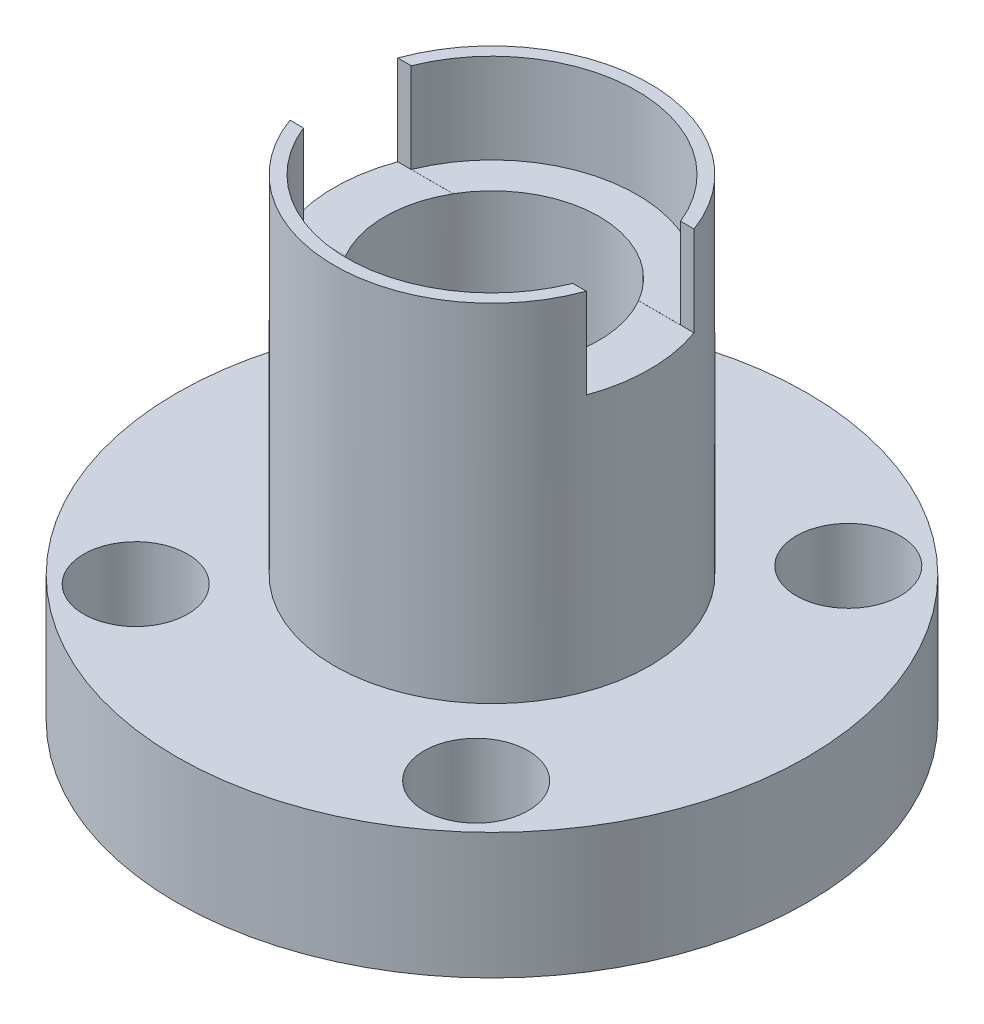
from build123d import *

# Parameters (mm, degrees)
SKETCH_1_R                   = 10
EXTRUDE_1_DEPTH              = 4
SKETCH_4_R                   = 1.65
CUT_EXTRUDE_1_DEPTH          = 4
SKETCH_5_R                   = 5
EXTRUDE_2_DEPTH              = 11
HOLE_WIZARD_M8_1_D           = 6.8
HOLE_WIZARD_M8_1_ON_FACE_2_D = 6.8
CUT_EXTRUDE_4_DEPTH          = 24.450776575
CUT_EXTRUDE_4_DEPTH_BACK     = 24.450776575
SKETCH_11_W                  = 3.417857142
SKETCH_11_H                  = 2.9
SKETCH_12_R                  = 4.6
CUT_EXTRUDE_5_DEPTH          = 2.85


with BuildPart() as part:
    # 草图1 → 凸台-拉伸1 (new body)
    with BuildSketch(Plane(origin=(0, 0, 0), x_dir=(1, 0, 0), z_dir=(0, 1, 0))):
        with Locations(Location((0, 0, 0), (0, 0, 270))):
            Circle(SKETCH_1_R)
    extrude(amount=EXTRUDE_1_DEPTH)

    # 草图4 → 切除-拉伸1 (cut)
    with BuildSketch(Plane(origin=(0, 0, 0), x_dir=(-1, 0, 0), z_dir=(0, -1, 0))):
        with Locations(Location((5.400107697, -5.902443296, 0), (0, 0, 90))):
            Circle(SKETCH_4_R)
        with Locations(Location((-5.400107697, -5.902443296, 0), (0, 0, 90))):
            Circle(SKETCH_4_R)
        with Locations(Location((-5.400107697, 5.902443296, 0), (0, 0, 90))):
            Circle(SKETCH_4_R)
        with Locations(Location((5.400107697, 5.902443296, 0), (0, 0, 90))):
            Circle(SKETCH_4_R)
    extrude(amount=-CUT_EXTRUDE_1_DEPTH, mode=Mode.SUBTRACT)

    # 草图5 → 凸台-拉伸2 (add)
    with BuildSketch(Plane(origin=(0, 4, 0), x_dir=(1, 0, 0), z_dir=(0, 1, 0))):
        with Locations(Location((0, 0, 0), (0, 0, 270))):
            Circle(SKETCH_5_R)
    extrude(amount=EXTRUDE_2_DEPTH)

    # M8 螺纹孔1 (through all)
    with Locations(Plane(origin=(0, 0, 0), x_dir=(0, 0, -1), z_dir=(0, -1, 0))):
        with Locations((0, 0)):
            Hole(HOLE_WIZARD_M8_1_D / 2)

    # M8 螺纹孔1 on face 2 (through all)
    with Locations(Plane.ZX.offset(15)):
        with Locations((0, 0)):
            Hole(HOLE_WIZARD_M8_1_ON_FACE_2_D / 2)

    # 草图11 → 切除-拉伸4 (cut, two sides: drawn at the far end of the back side and taken through both)
    with BuildSketch(Plane(origin=(4.997963928, 0, 0), x_dir=(0, 0, -1), z_dir=(1, 0, 0)).offset(-CUT_EXTRUDE_4_DEPTH_BACK)):
        with Locations((0, 13.597531036)):
            Rectangle(SKETCH_11_W, SKETCH_11_H)
    extrude(amount=CUT_EXTRUDE_4_DEPTH + CUT_EXTRUDE_4_DEPTH_BACK, mode=Mode.SUBTRACT)

    # 草图12 → 切除-拉伸5 (cut)
    with BuildSketch(Plane(origin=(0, 15, 0), x_dir=(1, 0, 0), z_dir=(0, 1, 0))):
        Circle(SKETCH_12_R)
    extrude(amount=-CUT_EXTRUDE_5_DEPTH, mode=Mode.SUBTRACT)


solid = part.part
